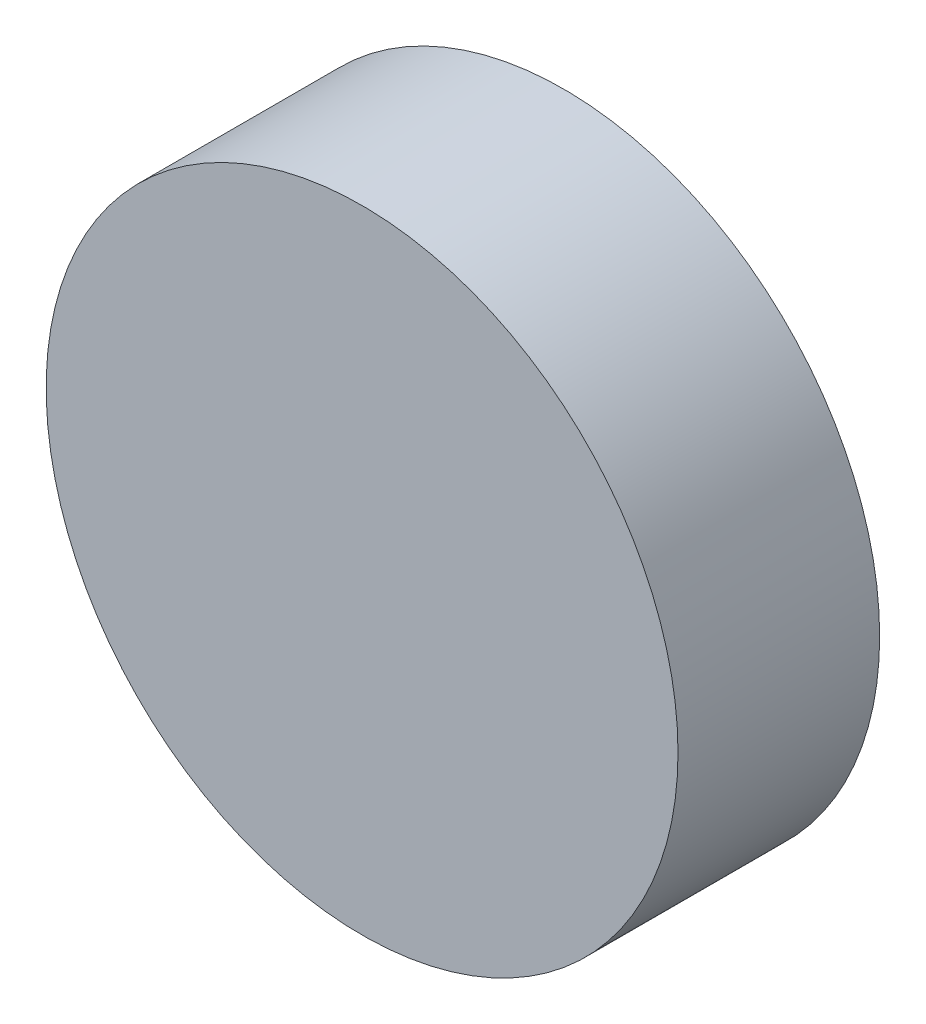
from build123d import *

# Parameters (mm, degrees)
SKETCH1_R           = 47
BOSS_EXTRUDE1_DEPTH = 15


with BuildPart() as part:
    # Sketch1 → Boss-Extrude1 (new, symmetric)
    with BuildSketch(Plane.XY):
        Circle(SKETCH1_R)
    extrude(amount=BOSS_EXTRUDE1_DEPTH, both=True)


solid = part.part
